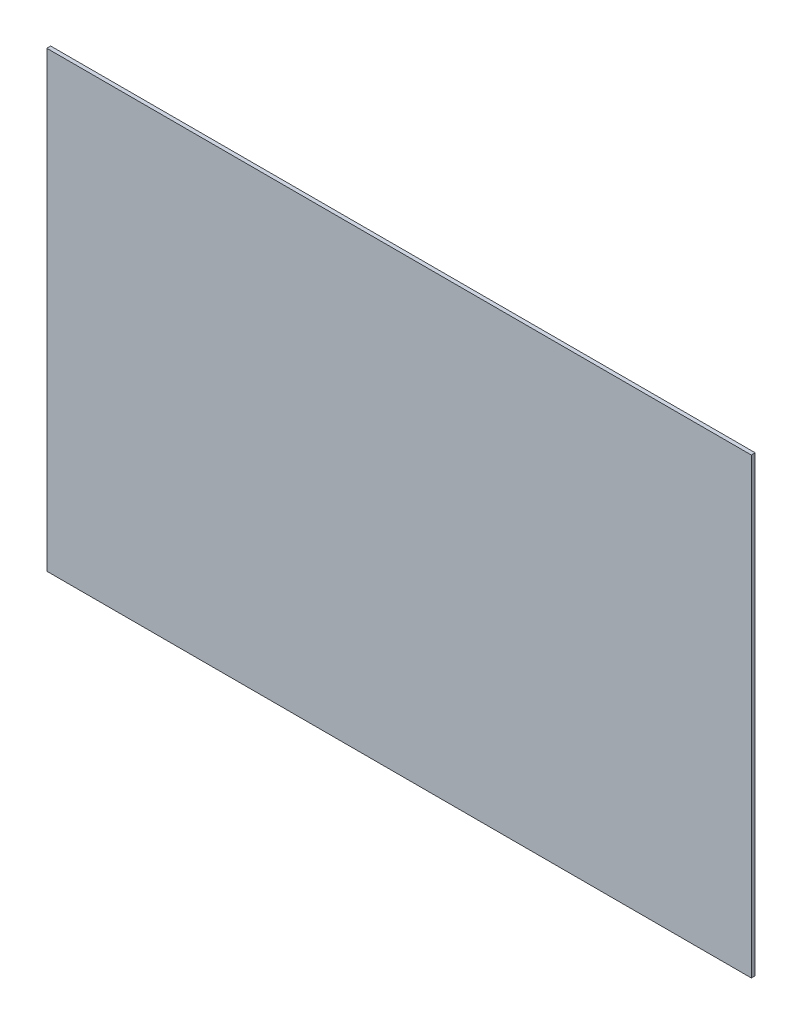
from build123d import *

# Parameters (mm, degrees)
SKETCH_1_W      = 182
SKETCH_1_H      = 117
EXTRUDE_1_DEPTH = 1


with BuildPart() as part:
    # 草图1 → 凸台-拉伸1 (new body)
    with BuildSketch(Plane.XY):
        Rectangle(SKETCH_1_W, SKETCH_1_H)
    extrude(amount=EXTRUDE_1_DEPTH)


solid = part.part
